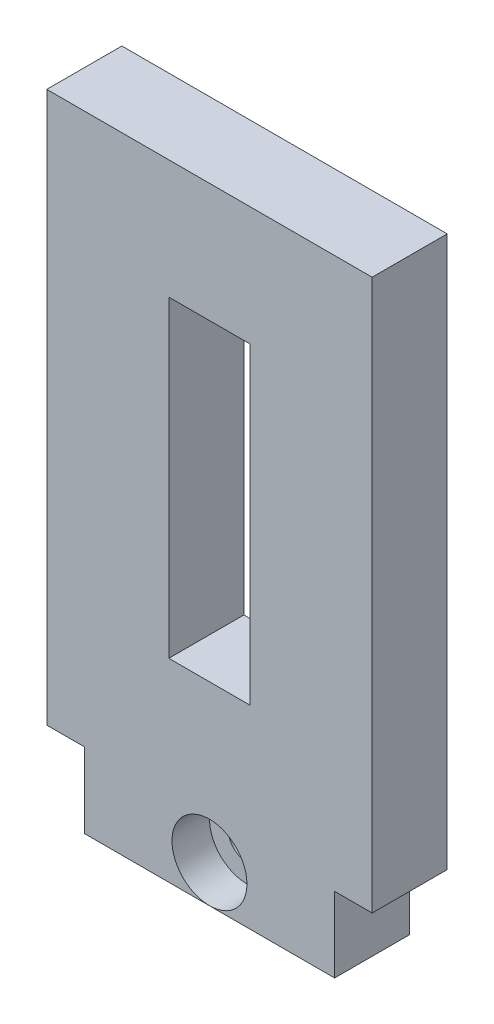
from build123d import *

# Parameters (mm, degrees)
ESQUISSE1_W             = 44
ESQUISSE1_H             = 44
BOSS_EXTRU_1_DEPTH      = 6
ESQUISSE2_W             = 20
ESQUISSE2_H             = 6
BOSS_EXTRU_3_DEPTH      = 6
ESQUISSE3_W             = 6.5
ESQUISSE3_H             = 25
ENL_V_MAT_EXTRU_1_DEPTH = 6
ESQUISSE4_W             = 9
ESQUISSE4_H             = 44
ENL_V_MAT_EXTRU_2_DEPTH = 6
ESQUISSE5_R             = 1.5
ENL_V_MAT_EXTRU_3_DEPTH = 6
ESQUISSE6_R             = 2.995
ENL_V_MAT_EXTRU_4_DEPTH = 3


with BuildPart() as part:
    # Esquisse1 → Boss.-Extru.1 (new body)
    with BuildSketch(Plane.XY):
        with Locations((22, 22)):
            Rectangle(ESQUISSE1_W, ESQUISSE1_H)
    extrude(amount=BOSS_EXTRU_1_DEPTH)

    # Esquisse2 → Boss.-Extru.3 (add)
    with BuildSketch(Plane.XY.offset(6)):
        with Locations((22, -3)):
            Rectangle(ESQUISSE2_W, ESQUISSE2_H)
    extrude(amount=-BOSS_EXTRU_3_DEPTH)

    # Esquisse3 → Enlèv. mat.-Extru.1 (cut)
    with BuildSketch(Plane.XY.offset(6)):
        with Locations((22, 22)):
            Rectangle(ESQUISSE3_W, ESQUISSE3_H)
    extrude(amount=-ENL_V_MAT_EXTRU_1_DEPTH, mode=Mode.SUBTRACT)

    # Esquisse4 → Enlèv. mat.-Extru.2 (cut)
    with BuildSketch(Plane.XY.offset(6)):
        with Locations((4.5, 22)):
            Rectangle(ESQUISSE4_W, ESQUISSE4_H)
        with Locations((39.5, 22)):
            Rectangle(ESQUISSE4_W, ESQUISSE4_H)
    extrude(amount=-ENL_V_MAT_EXTRU_2_DEPTH, mode=Mode.SUBTRACT)

    # Esquisse5 → Enlèv. mat.-Extru.3 (cut)
    with BuildSketch(Plane.XY.offset(6)):
        with Locations((22, -3)):
            Circle(ESQUISSE5_R)
    extrude(amount=-ENL_V_MAT_EXTRU_3_DEPTH, mode=Mode.SUBTRACT)

    # Esquisse6 → Enlèv. mat.-Extru.4 (cut)
    with BuildSketch(Plane.XY.offset(6)):
        with Locations((22, -3)):
            Circle(ESQUISSE6_R)
    extrude(amount=-ENL_V_MAT_EXTRU_4_DEPTH, mode=Mode.SUBTRACT)


solid = part.part
